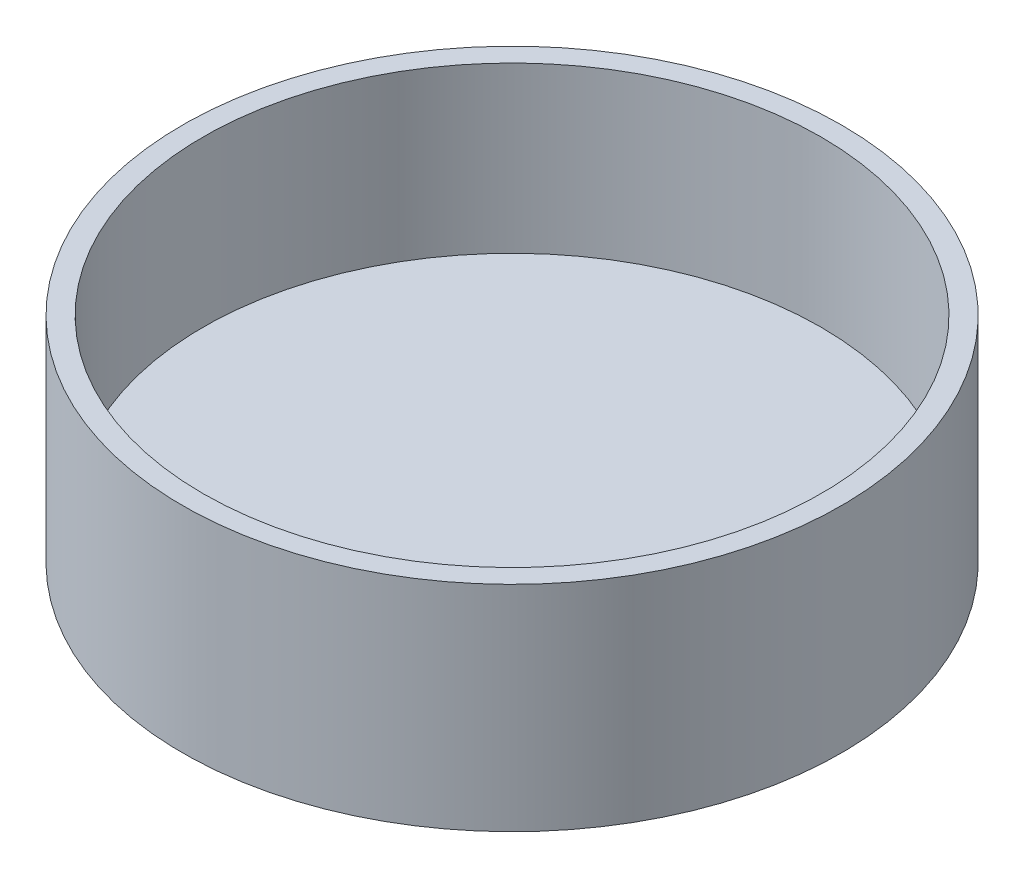
from build123d import *

# Parameters (mm, degrees)
SZKIC2_R                    = 80
DODANIE_WYCI_GNI_CIE1_DEPTH = 52
SZKIC3_R                    = 75
WYTNIJ_WYCI_GNI_CIE1_DEPTH  = 40


with BuildPart() as part:
    # Szkic2 → Dodanie-wyciągnięcie1 (new body)
    with BuildSketch(Plane(origin=(0, 0, 0), x_dir=(1, 0, 0), z_dir=(0, 1, 0))):
        with Locations(Location((0, 0, 0), (0, 0, 90))):
            Circle(SZKIC2_R)
    extrude(amount=DODANIE_WYCI_GNI_CIE1_DEPTH)

    # Szkic3 → Wytnij-wyciągnięcie1 (cut)
    with BuildSketch(Plane(origin=(0, 52, 0), x_dir=(1, 0, 0), z_dir=(0, 1, 0))):
        with Locations(Location((0, 0, 0), (0, 0, 270))):
            Circle(SZKIC3_R)
    extrude(amount=-WYTNIJ_WYCI_GNI_CIE1_DEPTH, mode=Mode.SUBTRACT)


solid = part.part
